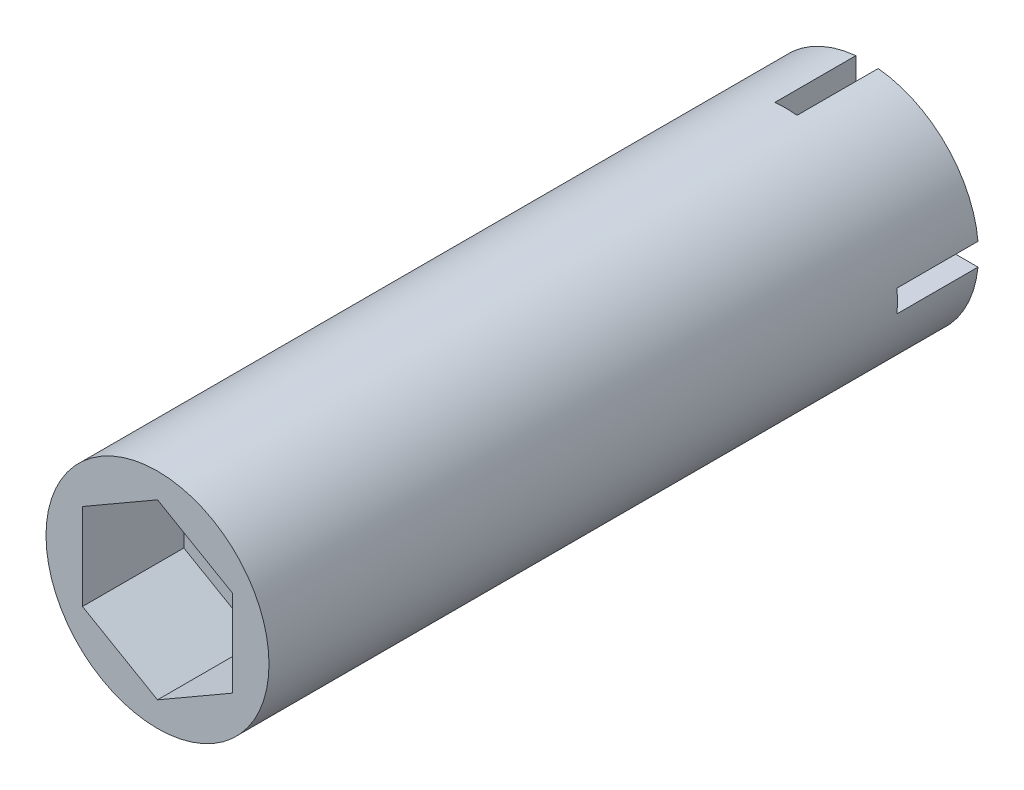
from build123d import *

# Parameters (mm, degrees)
ESQUISSE1_R             = 5.5
BOSS_EXTRU_1_DEPTH      = 35
ENL_V_MAT_EXTRU_1_DEPTH = 5
ESQUISSE3_R             = 2.25
ENL_V_MAT_EXTRU_2_DEPTH = 31.991934435
ENL_V_MAT_EXTRU_3_DEPTH = 4


with BuildPart() as part:
    # Esquisse1 → Boss.-Extru.1 (new body)
    with BuildSketch(Plane.XY):
        Circle(ESQUISSE1_R)
    extrude(amount=BOSS_EXTRU_1_DEPTH)

    # Esquisse2 → Enlèv. mat.-Extru.1 (cut)
    with BuildSketch(Plane.XY.offset(35)):
        Polygon((0, -4.272391992), (3.7, -2.136195996), (3.7, 2.136195996), (0, 4.272391992), (-3.7, 2.136195996), (-3.7, -2.136195996), align=None)
    extrude(amount=-ENL_V_MAT_EXTRU_1_DEPTH, mode=Mode.SUBTRACT)

    # Esquisse3 → Enlèv. mat.-Extru.2 (cut, through all)
    with BuildSketch(Plane.XY.offset(30)):
        Circle(ESQUISSE3_R)
    extrude(amount=-ENL_V_MAT_EXTRU_2_DEPTH, mode=Mode.SUBTRACT)

    # Esquisse4 → Enlèv. mat.-Extru.3 (cut)
    with BuildSketch(Plane(origin=(0, 0, 0), x_dir=(-1, 0, 0), z_dir=(0, 0, -1))):
        Polygon((-0.55, 5.5), (0.55, 5.5), (0.55, 0.55), (5.5, 0.55), (5.5, -0.55), (0.55, -0.55), (0.55, -5.5), (-0.55, -5.5), (-0.55, -0.55), (-5.5, -0.55), (-5.5, 0.55), (-0.55, 0.55), align=None)
    extrude(amount=-ENL_V_MAT_EXTRU_3_DEPTH, mode=Mode.SUBTRACT)


solid = part.part
